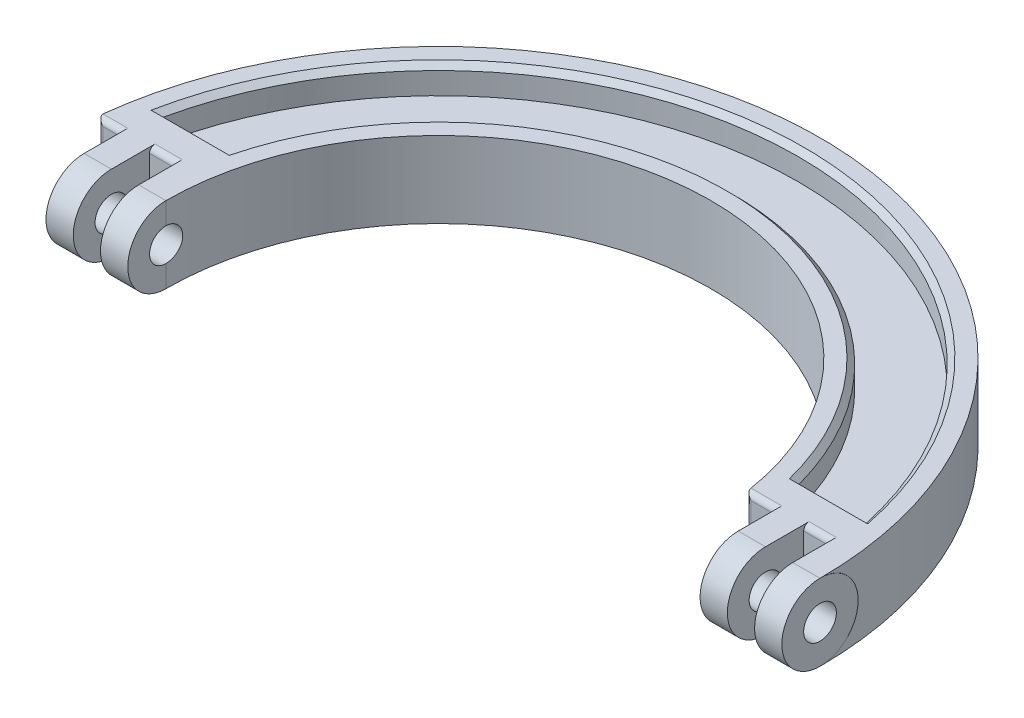
from build123d import *

# Parameters (mm, degrees)
EXTRUDE_1_DEPTH          = 7
CUT_EXTRUDE_3_DEPTH      = 2.5
CUT_EXTRUDE_6_DEPTH      = 2.5
CUT_EXTRUDE_6_DEPTH_BACK = 2.5
SKETCH_11_R              = 3.5
EXTRUDE_4_DEPTH          = 10
EXTRUDE_START            = -10
SKETCH_13_R              = 3.5
EXTRUDE_5_DEPTH          = 10
SKETCH_12_W              = 2.5
SKETCH_12_H              = 8.803448755
SKETCH_12_W_2            = 2.746212411
SKETCH_12_H_2            = 8.519621178
CUT_EXTRUDE_10_DEPTH     = 10
CHAMFER_1_SIZE           = 0.5
CHAMFER_2_SIZE           = 0.5
FILLET_1_R               = 0.5
SKETCH_14_R              = 1.5
CUT_EXTRUDE_11_DEPTH     = 123


with BuildPart() as part:
    # 草图2 → 凸台-拉伸1 (new body)
    with BuildSketch(Plane(origin=(0, 0, 0), x_dir=(1, 0, 0), z_dir=(0, 1, 0))):
        with BuildLine():
            Line((-35, 0), (-25, 0))
            ThreePointArc((-25, 0), (0, 25), (25, 0))
            Line((25, 0), (35, 0))
            ThreePointArc((35, 0), (0, 35), (-35, 0))
        make_face()
    extrude(amount=EXTRUDE_1_DEPTH)

    # 草图3 → 切除-拉伸3 (cut)
    with BuildSketch(Plane(origin=(0, 7, 0), x_dir=(1, 0, 0), z_dir=(0, 1, 0))):
        with BuildLine():
            Line((26.076809621, 7), (32.249030993, 7))
            ThreePointArc((32.249030993, 7), (0, 33), (-32.249030993, 7))
            Line((-32.249030993, 7), (-26.076809621, 7))
            ThreePointArc((-26.076809621, 7), (0, 27), (26.076809621, 7))
        make_face()
    extrude(amount=-CUT_EXTRUDE_3_DEPTH, mode=Mode.SUBTRACT)

    # 草图5 → 切除-拉伸6 (cut, two sides: drawn at the far end of the back side and taken through both)
    with BuildSketch(Plane(origin=(0, 0, 0), x_dir=(1, 0, 0), z_dir=(0, 1, 0)).offset(-CUT_EXTRUDE_6_DEPTH_BACK)):
        with BuildLine():
            Line((26.160532749, 7), (32.316767687, 7))
            ThreePointArc((32.316767687, 7), (0, 33.319691154), (-32.316767687, 7))
            Line((-32.316767687, 7), (-26.160532749, 7))
            ThreePointArc((-26.160532749, 7), (0, 27.319691154), (26.160532749, 7))
        make_face()
    extrude(amount=CUT_EXTRUDE_6_DEPTH + CUT_EXTRUDE_6_DEPTH_BACK, mode=Mode.SUBTRACT)

    # 草图11 → 凸台-拉伸4 (add)
    with BuildSketch(Plane.ZY.offset(35)):
        with Locations((0, 3.5)):
            Circle(SKETCH_11_R)
    extrude(amount=-EXTRUDE_4_DEPTH)

    # 草图13 → 凸台-拉伸5 (add)
    with BuildSketch(Plane(origin=(35, 0, 0), x_dir=(0, 0, -1), z_dir=(1, 0, 0)).offset(EXTRUDE_START)):
        with Locations((0, 3.5)):
            Circle(SKETCH_13_R)
    extrude(amount=EXTRUDE_5_DEPTH)

    # 草图12 → 切除-拉伸10 (cut)
    with BuildSketch(Plane(origin=(0, 7, 0), x_dir=(1, 0, 0), z_dir=(0, 1, 0))):
        with Locations((-33.75, -0.901724378)):
            Rectangle(SKETCH_12_W, SKETCH_12_H)
        with Locations((-28.75, -0.901724378)):
            Rectangle(SKETCH_12_W, SKETCH_12_H)
        with Locations((26.126893794, -0.759810589)):
            Rectangle(SKETCH_12_W_2, SKETCH_12_H_2)
        with Locations((31.25, -0.759810589)):
            Rectangle(SKETCH_12_W, SKETCH_12_H_2)
    extrude(amount=-CUT_EXTRUDE_10_DEPTH, mode=Mode.SUBTRACT)

    # 倒角1
    chamfer_1_edges = [part.edges().sort_by_distance(p)[0] for p in [
        (29.162920307, 7, -7),
        (0, 7, -27),
        (0, 7, -33),
        (-29.162920307, 7, -7),
    ]]
    chamfer(chamfer_1_edges, length=CHAMFER_1_SIZE)

    # 倒角2
    chamfer_2_edges = [part.edges().sort_by_distance(p)[0] for p in [
        (29.238650218, 0, -7),
        (0, 0, -33.319691154),
        (-29.238650218, 0, -7),
        (0, 0, -27.319691154),
    ]]
    chamfer(chamfer_2_edges, length=CHAMFER_2_SIZE)

    # 圆角1
    fillet_1_edges = [part.edges().sort_by_distance(p)[0] for p in [
        (-34.824560299, 3.5, -3.5),
        (-33.662280149, 0, -3.5),
        (-33.662280149, 7, -3.5),
        (-28.75, 7, -3.5),
        (-28.75, 0, -3.5),
        (31.25, 7, -3.5),
        (31.25, 0, -3.5),
        (26.126893794, 7, -3.5),
        (26.126893794, 0, -3.5),
        (24.753787589, 3.5, -3.5),
    ]]
    fillet(fillet_1_edges, radius=FILLET_1_R)

    # 草图14 → 切除-拉伸11 (cut)
    with BuildSketch(Plane(origin=(35, 0, 0), x_dir=(0, 0, -1), z_dir=(1, 0, 0))):
        with Locations((0, 3.5)):
            Circle(SKETCH_14_R)
    extrude(amount=-CUT_EXTRUDE_11_DEPTH, mode=Mode.SUBTRACT)


solid = part.part
